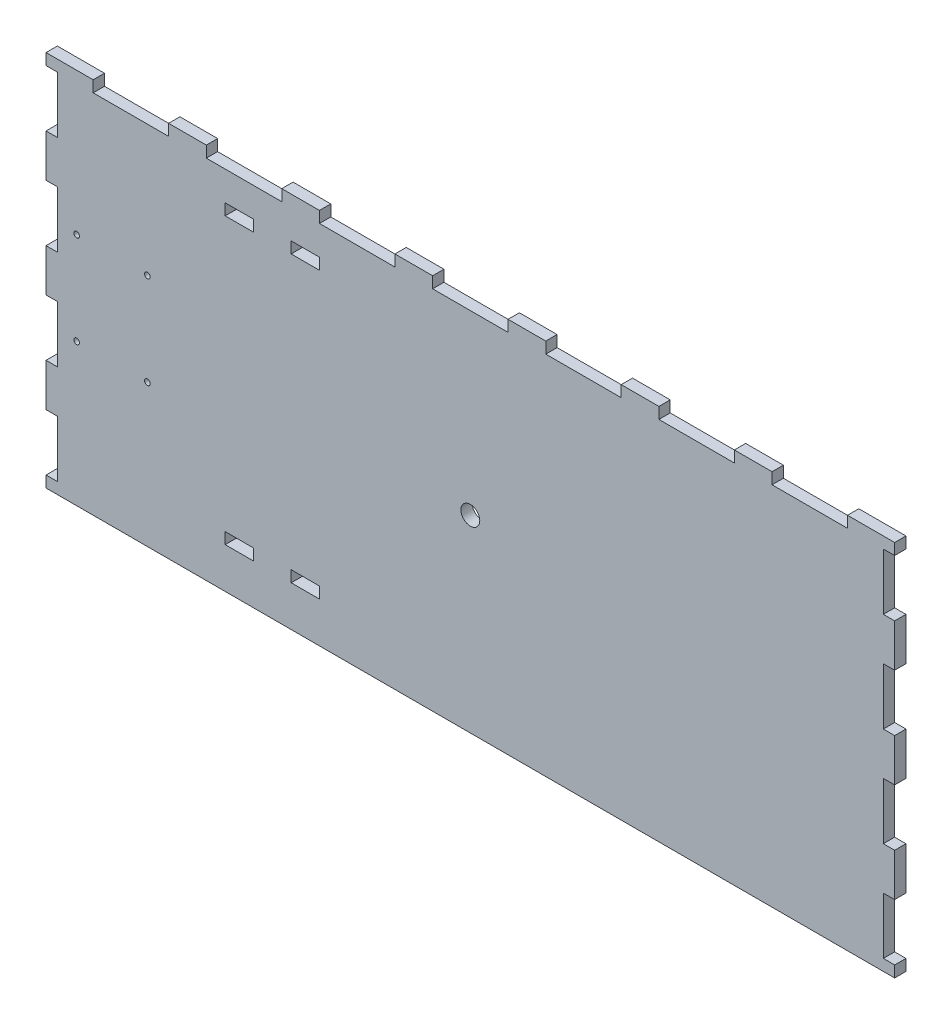
from build123d import *

# Parameters (mm, degrees)
ESQUISSE1_R        = 5
ESQUISSE1_R_2      = 1.5
ESQUISSE1_W        = 15
ESQUISSE1_H        = 6
BOSS_EXTRU_1_DEPTH = 6


with BuildPart() as part:
    # Esquisse1 → Boss.-Extru.1 (new body)
    with BuildSketch(Plane.XY):
        Polygon((0, 0), (450, 0), (450, 6), (444, 6), (444, 36), (450, 36), (450, 58.666666667), (444, 58.666666667), (444, 88.666666667), (450, 88.666666667), (450, 111.333333333), (444, 111.333333333), (444, 141.333333333), (450, 141.333333333), (450, 164), (444, 164), (444, 194), (450, 194), (450, 200), (425, 200), (425, 194), (385, 194), (385, 200), (365, 200), (365, 194), (325, 194), (325, 200), (305, 200), (305, 194), (265, 194), (265, 200), (245, 200), (245, 194), (205, 194), (205, 200), (185, 200), (185, 194), (145, 194), (145, 200), (125, 200), (125, 194), (85, 194), (85, 200), (65, 200), (65, 194), (25, 194), (25, 200), (0, 200), (0, 194), (6, 194), (6, 164), (0, 164), (0, 141.333333333), (6, 141.333333333), (6, 111.333333333), (0, 111.333333333), (0, 88.666666667), (6, 88.666666667), (6, 58.666666667), (0, 58.666666667), (0, 36), (6, 36), (6, 6), (0, 6), align=None)
        with Locations((225, 100)):
            Circle(ESQUISSE1_R, mode=Mode.SUBTRACT)
        with Locations((16.25, 124.5)):
            Circle(ESQUISSE1_R_2, mode=Mode.SUBTRACT)
        with Locations((53.75, 124.5)):
            Circle(ESQUISSE1_R_2, mode=Mode.SUBTRACT)
        with Locations(Location((53.75, 75.5, 0), (0, 0, 180))):
            Circle(ESQUISSE1_R_2, mode=Mode.SUBTRACT)
        with Locations(Location((16.25, 75.5, 0), (0, 0, 180))):
            Circle(ESQUISSE1_R_2, mode=Mode.SUBTRACT)
        with Locations((137.5, 24.5)):
            Rectangle(ESQUISSE1_W, ESQUISSE1_H, mode=Mode.SUBTRACT)
        with Locations((102.5, 175.5)):
            Rectangle(ESQUISSE1_W, ESQUISSE1_H, mode=Mode.SUBTRACT)
        with Locations((137.5, 175.5)):
            Rectangle(ESQUISSE1_W, ESQUISSE1_H, mode=Mode.SUBTRACT)
        with Locations((102.5, 24.5)):
            Rectangle(ESQUISSE1_W, ESQUISSE1_H, mode=Mode.SUBTRACT)
    extrude(amount=BOSS_EXTRU_1_DEPTH)


solid = part.part
